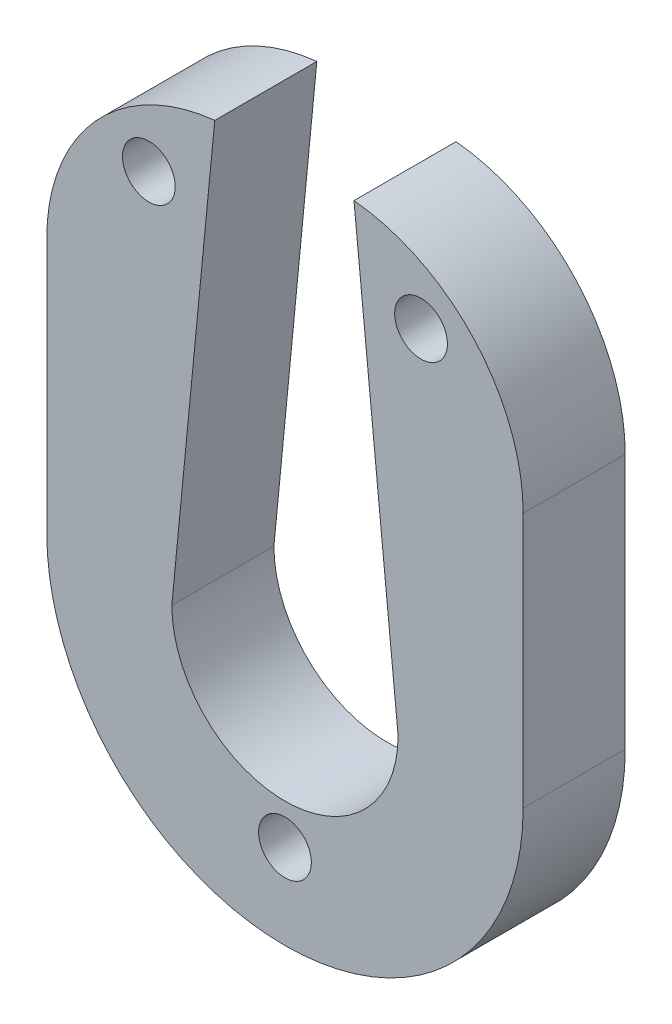
from build123d import *

# Parameters (mm, degrees)
DODANIE_WYCI_GNI_CIE1_DEPTH = 6
SZKIC3_R                    = 1.55
WYTNIJ_WYCI_GNI_CIE2_DEPTH  = 6
SZKIC4_R                    = 1.55
WYTNIJ_WYCI_GNI_CIE3_DEPTH  = 6
WYTNIJ_WYCI_GNI_CIE4_DEPTH  = 6


with BuildPart() as part:
    # Szkic1 → Dodanie-wyciągnięcie1 (new body)
    with BuildSketch(Plane.XY):
        with BuildLine():
            Line((-174.181077779, 72.924846477), (-174.181077779, 87.924846477))
            ThreePointArc((-174.181077779, 87.924846477), (-177.402903186, 95.70302107), (-185.181077779, 98.924846477))
            Line((-185.181077779, 98.924846477), (-191.181077779, 98.924846477))
            ThreePointArc((-191.181077779, 98.924846477), (-198.959252372, 95.70302107), (-202.181077779, 87.924846477))
            Line((-202.181077779, 87.924846477), (-202.181077779, 72.924846477))
            ThreePointArc((-202.181077779, 72.924846477), (-188.181077779, 58.924846477), (-174.181077779, 72.924846477))
        make_face()
    extrude(amount=-DODANIE_WYCI_GNI_CIE1_DEPTH)

    # Szkic3 → Wytnij-wyciągnięcie2 (cut)
    with BuildSketch(Plane.XY):
        with Locations((-196.181077779, 94.324819795)):
            Circle(SZKIC3_R)
        with Locations((-180.181077779, 94.324819795)):
            Circle(SZKIC3_R)
        with Locations((-188.181077779, 63.924846477)):
            Circle(SZKIC3_R)
    extrude(amount=-WYTNIJ_WYCI_GNI_CIE2_DEPTH, mode=Mode.SUBTRACT)

    # Szkic4 → Wytnij-wyciągnięcie3 (cut)
    with BuildSketch(Plane.XY):
        with Locations((-188.181077779, 72.924846477)):
            Circle(SZKIC4_R)
    extrude(amount=-WYTNIJ_WYCI_GNI_CIE3_DEPTH, mode=Mode.SUBTRACT)

    # Szkic7 → Wytnij-wyciągnięcie4 (cut)
    with BuildSketch(Plane(origin=(0, 0, -6), x_dir=(-1, 0, 0), z_dir=(0, 0, -1))):
        with BuildLine():
            Line((181.531097956, 72.941227743), (184.470707897, 102.337327159))
            ThreePointArc((184.470707897, 102.337327159), (188.225739241, 106.074816392), (191.97068627, 102.327222776))
            Line((191.97068627, 102.327222776), (194.831077602, 72.923309279))
            ThreePointArc((194.831077602, 72.923309279), (188.172118542, 66.274852512), (181.531097956, 72.941227743))
        make_face()
    extrude(amount=-WYTNIJ_WYCI_GNI_CIE4_DEPTH, mode=Mode.SUBTRACT)


solid = part.part
